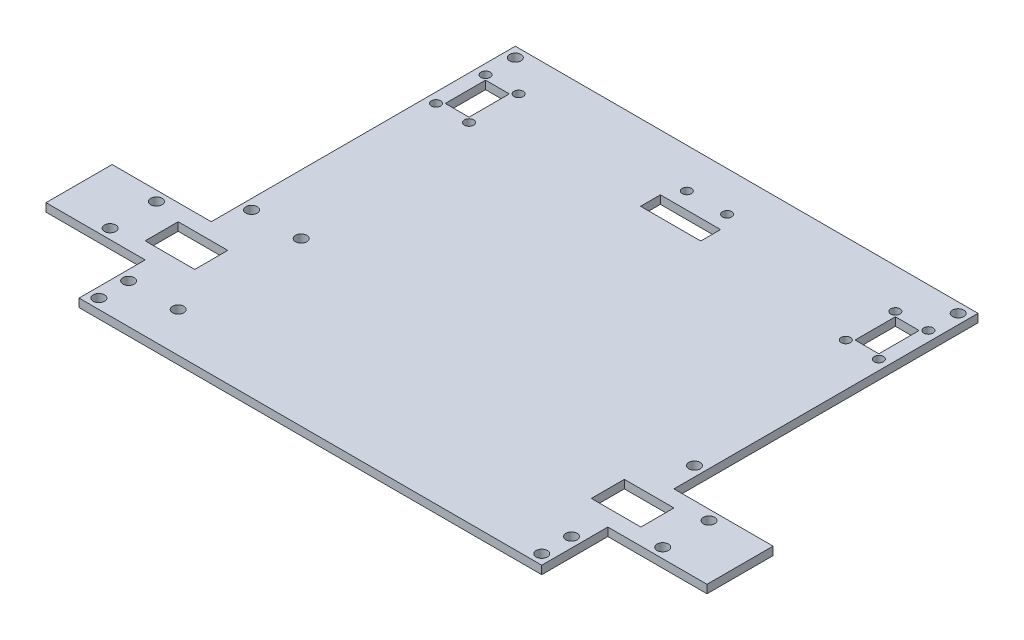
from build123d import *

# Parameters (mm, degrees)
BOSS_EXTRUDE1_DEPTH = 3.175
SKETCH2_R           = 2.1717
SKETCH2_R_2         = 1.778
SKETCH2_W           = 9.144
SKETCH2_H           = 15.494
SKETCH2_W_2         = 23.114
SKETCH2_H_2         = 7.62
SKETCH2_W_3         = 19.05
SKETCH2_H_3         = 12.7
CUT_EXTRUDE1_DEPTH  = 3.175


with BuildPart() as part:
    # Sketch1 → Boss-Extrude1 (new body)
    with BuildSketch(Plane(origin=(0, 0, 0), x_dir=(1, 0, 0), z_dir=(0, 1, 0))):
        Polygon((-52.922181171, 15.760280827), (124.877818829, 15.760280827), (124.877818829, -101.079719173), (162.977818829, -101.079719173), (162.977818829, -126.479719173), (124.877818829, -126.479719173), (124.877818829, -151.879719173), (-52.922181171, -151.879719173), (-52.922181171, -126.479719173), (-91.022181171, -126.479719173), (-91.022181171, -101.079719173), (-52.922181171, -101.079719173), align=None)
    extrude(amount=BOSS_EXTRUDE1_DEPTH)

    # Sketch2 → Cut-Extrude1 (cut)
    with BuildSketch(Plane(origin=(0, 3.175, 0), x_dir=(1, 0, 0), z_dir=(0, 1, 0))):
        with Locations(Location((-49.112181171, 11.950280827, 0), (0, 0, 270))):
            Circle(SKETCH2_R)
        with Locations(Location((121.067818829, 11.950280827, 0), (0, 0, 270))):
            Circle(SKETCH2_R)
        with Locations(Location((-49.112181171, -148.069719173, 0), (0, 0, 270))):
            Circle(SKETCH2_R)
        with Locations(Location((121.067818829, -148.069719173, 0), (0, 0, 270))):
            Circle(SKETCH2_R)
        with Locations(Location((-49.112181171, -136.639719173, 0), (0, 0, 270))):
            Circle(SKETCH2_R)
        with Locations(Location((-49.112181171, -89.395719173, 0), (0, 0, 270))):
            Circle(SKETCH2_R)
        with Locations(Location((-30.062181171, -136.639719173, 0), (0, 0, 270))):
            Circle(SKETCH2_R)
        with Locations(Location((-30.062181171, -89.395719173, 0), (0, 0, 270))):
            Circle(SKETCH2_R)
        with Locations(Location((121.067818829, -136.639719173, 0), (0, 0, 270))):
            Circle(SKETCH2_R)
        with Locations(Location((121.067818829, -89.395719173, 0), (0, 0, 270))):
            Circle(SKETCH2_R)
        with Locations(Location((-49.112181171, 0.520280827, 0), (0, 0, 270))):
            Circle(SKETCH2_R_2)
        with Locations(Location((-49.112181171, -18.529719173, 0), (0, 0, 270))):
            Circle(SKETCH2_R_2)
        with Locations(Location((-36.412181171, 0.520280827, 0), (0, 0, 270))):
            Circle(SKETCH2_R_2)
        with Locations(Location((-36.412181171, -18.529719173, 0), (0, 0, 270))):
            Circle(SKETCH2_R_2)
        with Locations(Location((121.067818829, 0.520280827, 0), (0, 0, 270))):
            Circle(SKETCH2_R_2)
        with Locations(Location((121.067818829, -18.529719173, 0), (0, 0, 270))):
            Circle(SKETCH2_R_2)
        with Locations(Location((108.367818829, 0.520280827, 0), (0, 0, 270))):
            Circle(SKETCH2_R_2)
        with Locations(Location((108.367818829, -18.529719173, 0), (0, 0, 270))):
            Circle(SKETCH2_R_2)
        with Locations(Location((28.230818829, 0.520280827, 0), (0, 0, 270))):
            Circle(SKETCH2_R_2)
        with Locations(Location((43.724818829, 0.520280827, 0), (0, 0, 270))):
            Circle(SKETCH2_R_2)
        with Locations(Location((-70.194181171, -104.889719173, 0), (0, 0, 270))):
            Circle(SKETCH2_R)
        with Locations(Location((-70.194181171, -122.669719173, 0), (0, 0, 270))):
            Circle(SKETCH2_R)
        with Locations(Location((142.149818829, -104.889719173, 0), (0, 0, 270))):
            Circle(SKETCH2_R)
        with Locations(Location((142.149818829, -122.669719173, 0), (0, 0, 270))):
            Circle(SKETCH2_R)
        with Locations((-42.762181171, -9.004719173)):
            Rectangle(SKETCH2_W, SKETCH2_H)
        with Locations((114.717818829, -9.004719173)):
            Rectangle(SKETCH2_W, SKETCH2_H)
        with Locations((35.977818829, -9.639719173)):
            Rectangle(SKETCH2_W_2, SKETCH2_H_2)
        with Locations((-49.747181171, -113.779719173)):
            Rectangle(SKETCH2_W_3, SKETCH2_H_3)
        with Locations((121.702818829, -113.779719173)):
            Rectangle(SKETCH2_W_3, SKETCH2_H_3)
    extrude(amount=-CUT_EXTRUDE1_DEPTH, mode=Mode.SUBTRACT)


solid = part.part
